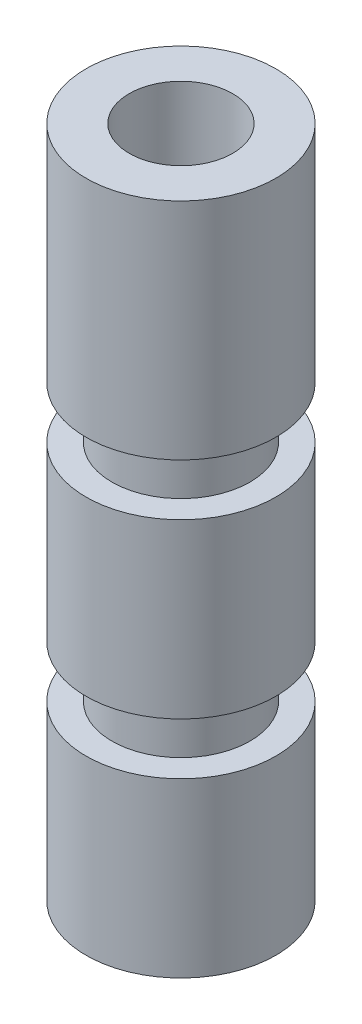
from build123d import *

# Parameters (mm, degrees)
SKETCH_1_R      = 2.75
SKETCH_1_R_2    = 1.5
EXTRUDE_1_DEPTH = 6.5
EXTRUDE_START   = 1.5
SKETCH_2_R      = 2
SKETCH_2_R_2    = 1.5
EXTRUDE_2_DEPTH = 1.5
EXTRUDE_START_2 = 5
SKETCH_3_R      = 2.75
SKETCH_3_R_2    = 1.5
EXTRUDE_3_DEPTH = 5
SKETCH_4_R      = 2
SKETCH_4_R_2    = 1.5
EXTRUDE_4_DEPTH = 1.5
SKETCH_5_R      = 2.75
SKETCH_5_R_2    = 1.5
EXTRUDE_5_DEPTH = 5


with BuildPart() as part:
    # 草图1 → 凸台-拉伸1 (new body)
    with BuildSketch(Plane(origin=(0, 0, 0), x_dir=(1, 0, 0), z_dir=(0, 1, 0))):
        with Locations(Location((0, 0, 0), (0, 0, 90))):
            Circle(SKETCH_1_R)
        with Locations(Location((0, 0, 0), (0, 0, 90))):
            Circle(SKETCH_1_R_2, mode=Mode.SUBTRACT)
    extrude(amount=EXTRUDE_1_DEPTH)

    # 草图2 → 凸台-拉伸2 (add)
    with BuildSketch(Plane.XZ.offset(EXTRUDE_START)):
        with Locations(Location((0, 0, 0), (0, 0, 90))):
            Circle(SKETCH_2_R)
        with Locations(Location((0, 0, 0), (0, 0, 270))):
            Circle(SKETCH_2_R_2, mode=Mode.SUBTRACT)
    extrude(amount=-EXTRUDE_2_DEPTH)

    # 草图3 → 凸台-拉伸3 (add)
    with BuildSketch(Plane.XZ.offset(1.5).offset(EXTRUDE_START_2)):
        with Locations(Location((0, 0, 0), (0, 0, 270))):
            Circle(SKETCH_3_R)
        with Locations(Location((0, 0, 0), (0, 0, 270))):
            Circle(SKETCH_3_R_2, mode=Mode.SUBTRACT)
    extrude(amount=-EXTRUDE_3_DEPTH)

    # 草图4 → 凸台-拉伸4 (add)
    with BuildSketch(Plane.XZ.offset(6.5).offset(EXTRUDE_START)):
        with Locations(Location((0, 0, 0), (0, 0, 90))):
            Circle(SKETCH_4_R)
        with Locations(Location((0, 0, 0), (0, 0, 270))):
            Circle(SKETCH_4_R_2, mode=Mode.SUBTRACT)
    extrude(amount=-EXTRUDE_4_DEPTH)

    # 草图5 → 凸台-拉伸5 (add)
    with BuildSketch(Plane.XZ.offset(8).offset(EXTRUDE_START_2)):
        with Locations(Location((0, 0, 0), (0, 0, 270))):
            Circle(SKETCH_5_R)
        with Locations(Location((0, 0, 0), (0, 0, 270))):
            Circle(SKETCH_5_R_2, mode=Mode.SUBTRACT)
    extrude(amount=-EXTRUDE_5_DEPTH)


solid = part.part
